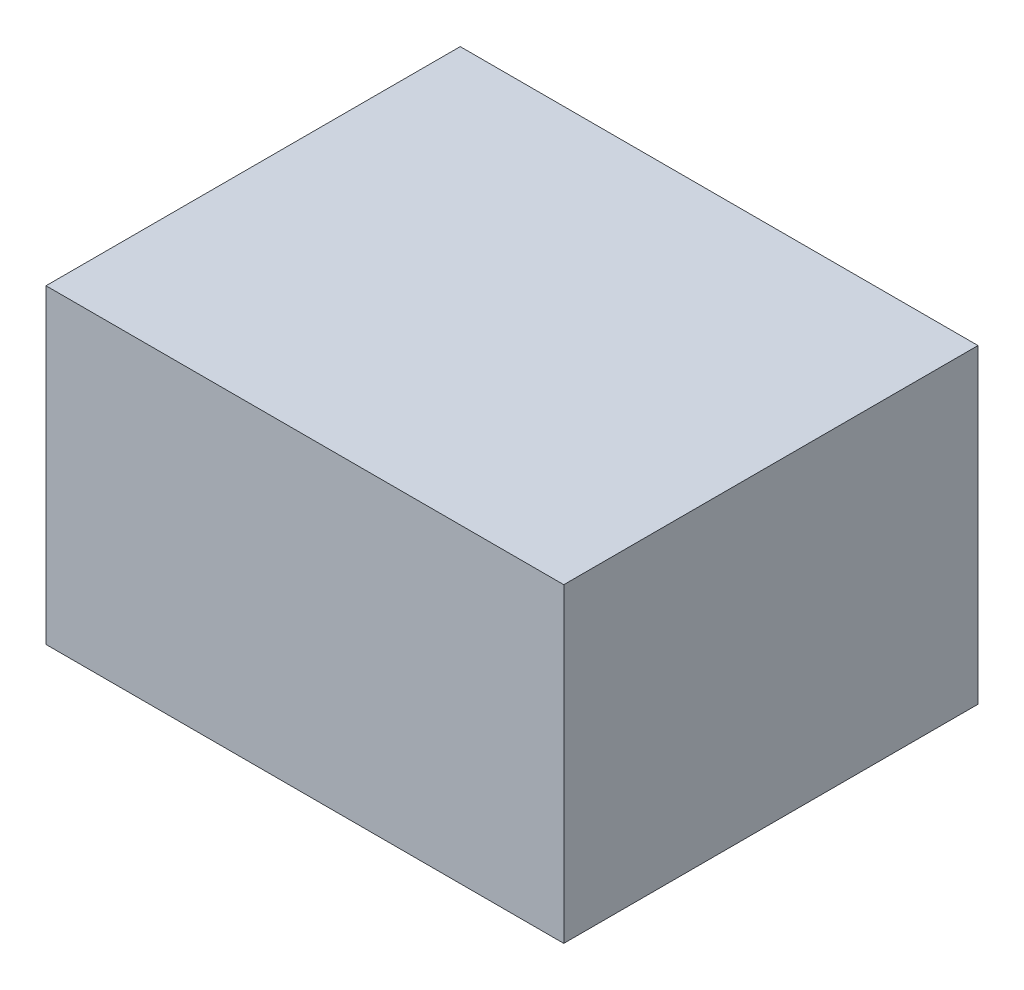
from build123d import *

# Parameters (mm, degrees)
SKETCH_1_W      = 25
SKETCH_1_H      = 15
EXTRUDE_1_DEPTH = 20


with BuildPart() as part:
    # 草图1 → 凸台-拉伸1 (new body)
    with BuildSketch(Plane.XY):
        Rectangle(SKETCH_1_W, SKETCH_1_H)
    extrude(amount=EXTRUDE_1_DEPTH)


solid = part.part
